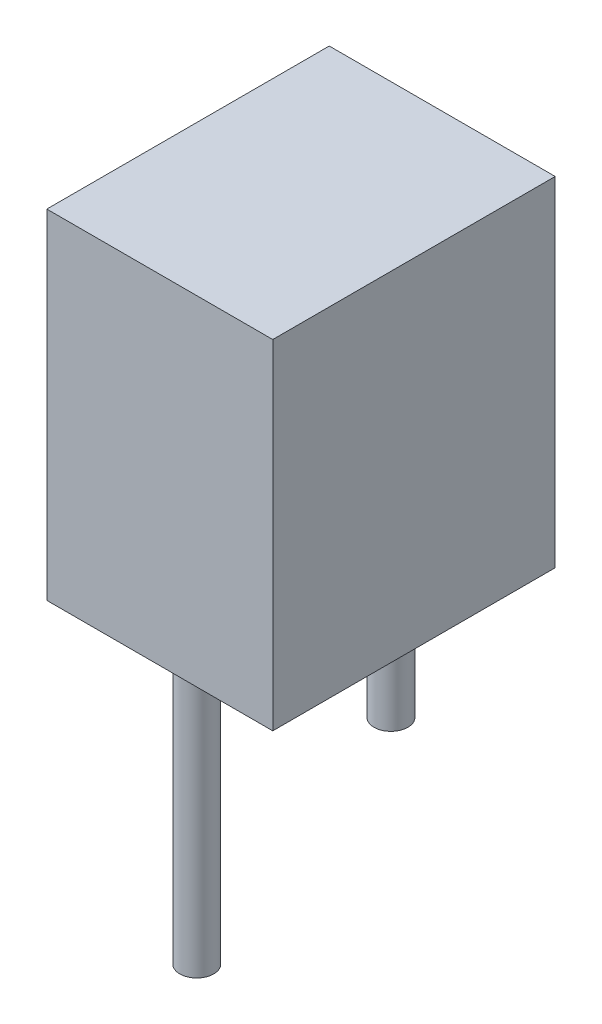
from build123d import *

# Parameters (mm, degrees)
SKETCH1_W           = 20
SKETCH1_H           = 30
BOSS_EXTRUDE1_DEPTH = 12.5
SKETCH2_R           = 1.5
BOSS_EXTRUDE2_DEPTH = 30
CUT_EXTRUDE1_START  = -21
SKETCH3_R           = 1.5
CUT_EXTRUDE1_DEPTH  = 21
CUT_EXTRUDE2_DEPTH  = 1


with BuildPart() as part:
    # Sketch1 → Boss-Extrude1 (new, symmetric)
    with BuildSketch(Plane.XY):
        Rectangle(SKETCH1_W, SKETCH1_H)
    extrude(amount=BOSS_EXTRUDE1_DEPTH, both=True)

    # Sketch2 → Boss-Extrude2 (add)
    with BuildSketch(Plane.XZ.offset(15)):
        with Locations(Location((-5.475979832, 3.75, 0), (0, 0, 180))):
            Circle(SKETCH2_R)
        with Locations(Location((5.2112799, -2.75, 0), (0, 0, 180))):
            Circle(SKETCH2_R)
    extrude(amount=BOSS_EXTRUDE2_DEPTH)

    # Sketch3 → Cut-Extrude1 (cut)
    with BuildSketch(Plane.XZ.offset(45).offset(CUT_EXTRUDE1_START)):
        with Locations(Location((5.2112799, -2.75, 0), (0, 0, 180))):
            Circle(SKETCH3_R)
    extrude(amount=CUT_EXTRUDE1_DEPTH, mode=Mode.SUBTRACT)

    # Sketch4 → Cut-Extrude2 (cut)
    # profile 1 of 17: a face of its own
    with BuildSketch(Plane(origin=(0, 0, -12.5), x_dir=(-1, 0, 0), z_dir=(0, 0, -1))):
        with BuildLine():
            Line((-5.418014107, 4.812145951), (-4.901779799, 4.812145951))
            add(Edge.make_bspline(
                [(-4.901779799, 4.812145951), (-4.876509461, 4.812013092), (-4.827529258, 4.811755578), (-4.756303846, 4.807761783), (-4.689591948, 4.802316152), (-4.627374215, 4.793675546), (-4.569679398, 4.783249619), (-4.516333625, 4.770623841), (-4.46750653, 4.755484675), (-4.409212974, 4.731410403), (-4.342749141, 4.695636341), (-4.270783689, 4.642773676), (-4.209245961, 4.578115207), (-4.156188447, 4.505178914), (-4.114005458, 4.424945324), (-4.083488191, 4.339326771), (-4.064167655, 4.249427597), (-4.062180684, 4.187709242), (-4.0611765, 4.156517779)],
                knots=[0, 0, 0, 0, 1.001505555, 1.941167018, 2.826882275, 3.653841531, 4.429895133, 5.150066043, 5.825578002, 6.45369114, 7.647487171, 8.808567382, 9.977351308, 11.170798116, 12.373658725, 13.556498008, 14.765093433, 16, 16, 16, 16], degree=3))
            add(Edge.make_bspline(
                [(-4.0611765, 4.156517779), (-4.062002921, 4.127298288), (-4.063626917, 4.069879232), (-4.079156265, 3.985897375), (-4.103468199, 3.905954489), (-4.137263238, 3.830342329), (-4.18118558, 3.7607693), (-4.23323919, 3.696674164), (-4.296041297, 3.640770687), (-4.343094222, 3.609517421), (-4.366994977, 3.593642178)],
                knots=[0, 0, 0, 0, 1.044552857, 2.05264487, 3.044412934, 4.028983338, 5.005914585, 5.980388656, 6.974128949, 8, 8, 8, 8], degree=3))
            add(Edge.make_bspline(
                [(-4.366994977, 3.593642178), (-4.336937987, 3.582102566), (-4.279431519, 3.560024429), (-4.200293879, 3.520990477), (-4.132110871, 3.478534596), (-4.074358267, 3.432170638), (-4.024966111, 3.382195525), (-3.981836804, 3.32787648), (-3.945036003, 3.268504919), (-3.913503019, 3.204699866), (-3.88889771, 3.137112833), (-3.870470687, 3.066377782), (-3.85991196, 2.992748357), (-3.858409398, 2.942639766), (-3.857650859, 2.917343434)],
                knots=[0, 0, 0, 0, 1.27268992, 2.434971085, 3.483601985, 4.442670788, 5.356604649, 6.2567628, 7.179492994, 8.113709626, 9.066344395, 10.018646069, 10.999752585, 12, 12, 12, 12], degree=3))
            add(Edge.make_bspline(
                [(-3.857650859, 2.917343434), (-3.858389308, 2.891514905), (-3.859842228, 2.840696552), (-3.870561611, 2.766042373), (-3.888711353, 2.694699408), (-3.913711565, 2.626206204), (-3.946340219, 2.560695269), (-3.986048859, 2.498092385), (-4.033395338, 2.439026552), (-4.086359531, 2.382841432), (-4.146277939, 2.332322807), (-4.210923777, 2.287331767), (-4.281111174, 2.250330875), (-4.355687383, 2.21924912), (-4.43548898, 2.195506774), (-4.520157617, 2.178896554), (-4.609620274, 2.167704651), (-4.671010979, 2.166784502), (-4.702494275, 2.166312618)],
                knots=[0, 0, 0, 0, 0.978564426, 1.925352924, 2.850884081, 3.763762016, 4.682927383, 5.618979971, 6.567305752, 7.547517671, 8.540179244, 9.531824382, 10.526200242, 11.540722885, 12.589160233, 13.674978461, 14.80764778, 16, 16, 16, 16], degree=3))
            Line((-4.702494275, 2.166312618), (-5.418014107, 2.166312618))
            Line((-5.418014107, 2.166312618), (-5.418014107, 4.812145951))
        make_face()
        with BuildLine():
            Line((-5.180567526, 4.54077843), (-5.180567526, 3.692754925))
            Line((-5.180567526, 3.692754925), (-5.021033104, 3.692754925))
            add(Edge.make_bspline(
                [(-5.021033104, 3.692754925), (-4.997712884, 3.693057248), (-4.952653466, 3.693641397), (-4.887399735, 3.695314711), (-4.826829036, 3.700000137), (-4.771045924, 3.704684216), (-4.720138244, 3.712300124), (-4.674218777, 3.721365598), (-4.632566861, 3.73095327), (-4.584533991, 3.747258775), (-4.530050274, 3.77135678), (-4.471968106, 3.808755132), (-4.420764072, 3.853299137), (-4.377525722, 3.904697067), (-4.342138479, 3.961292338), (-4.317559659, 4.022181944), (-4.300892962, 4.085848353), (-4.299387459, 4.129556199), (-4.298623082, 4.151747647)],
                knots=[0, 0, 0, 0, 1.156816544, 2.235205308, 3.236616184, 4.169592532, 5.011045266, 5.787822928, 6.49130361, 7.128639758, 8.301311294, 9.436451833, 10.541879658, 11.654887649, 12.756523258, 13.837046038, 14.901820046, 16, 16, 16, 16], degree=3))
            add(Edge.make_bspline(
                [(-4.298623082, 4.151747647), (-4.299020849, 4.166432605), (-4.299801112, 4.195238755), (-4.306191407, 4.237231421), (-4.317052609, 4.27672521), (-4.331003176, 4.314261353), (-4.350498196, 4.348666145), (-4.373451529, 4.381129156), (-4.401184164, 4.410544864), (-4.432750704, 4.438038473), (-4.469042936, 4.462413801), (-4.51003921, 4.483762473), (-4.556294181, 4.500953417), (-4.607028303, 4.51600908), (-4.663022518, 4.526583564), (-4.723630663, 4.53539297), (-4.78934917, 4.539877841), (-4.834816004, 4.540471538), (-4.858318594, 4.54077843)],
                knots=[0, 0, 0, 0, 0.91205012, 1.789085906, 2.630437955, 3.453916878, 4.269457761, 5.079663411, 5.91843418, 6.774407191, 7.675494373, 8.627863946, 9.638891023, 10.736472738, 11.911756761, 13.175263542, 14.539845004, 16, 16, 16, 16], degree=3))
            Line((-4.858318594, 4.54077843), (-5.180567526, 4.54077843))
        make_face(mode=Mode.SUBTRACT)
        with BuildLine():
            Line((-5.180567526, 3.421387404), (-5.180567526, 2.437680139))
            Line((-5.180567526, 2.437680139), (-4.842418154, 2.437680139))
            add(Edge.make_bspline(
                [(-4.842418154, 2.437680139), (-4.81821337, 2.437970234), (-4.771561842, 2.438529353), (-4.704205555, 2.440354642), (-4.641776661, 2.44450654), (-4.584560034, 2.451042391), (-4.531937847, 2.458132052), (-4.484541369, 2.46766558), (-4.441986395, 2.478588306), (-4.392642127, 2.495471877), (-4.337076975, 2.521700757), (-4.277197339, 2.561247821), (-4.223958472, 2.608361273), (-4.178748544, 2.66288881), (-4.141697059, 2.722179158), (-4.114743232, 2.785033083), (-4.098119192, 2.850412024), (-4.096106719, 2.89498805), (-4.095097441, 2.917343434)],
                knots=[0, 0, 0, 0, 1.160039823, 2.235823828, 3.228722157, 4.157150951, 4.99529583, 5.772374946, 6.472645482, 7.099169577, 8.269452708, 9.405989375, 10.527446681, 11.663510218, 12.788923519, 13.866172445, 14.929861265, 16, 16, 16, 16], degree=3))
            add(Edge.make_bspline(
                [(-4.095097441, 2.917343434), (-4.095306162, 2.931323519), (-4.095720239, 2.959058188), (-4.101964871, 2.99981598), (-4.111046784, 3.039296253), (-4.122787808, 3.077606212), (-4.139887048, 3.114053228), (-4.159849139, 3.14935814), (-4.183254484, 3.183567615), (-4.219724776, 3.226817354), (-4.272771455, 3.276647477), (-4.348145029, 3.325434756), (-4.433849088, 3.364780419), (-4.496009157, 3.381486571), (-4.528119442, 3.390116537)],
                knots=[0, 0, 0, 0, 0.723448775, 1.435228256, 2.130040452, 2.821711965, 3.505591119, 4.210454504, 4.921174351, 5.648778258, 7.137944449, 8.670945889, 10.280296675, 12, 12, 12, 12], degree=3))
            add(Edge.make_bspline(
                [(-4.528119442, 3.390116537), (-4.540992628, 3.392728416), (-4.56890435, 3.398391509), (-4.614418413, 3.404369356), (-4.666379457, 3.409695086), (-4.724907465, 3.413634473), (-4.790076488, 3.417706443), (-4.862025706, 3.419290028), (-4.940461296, 3.42117935), (-4.994884101, 3.421316279), (-5.023153163, 3.421387404)],
                knots=[0, 0, 0, 0, 0.634451884, 1.375622551, 2.216452059, 3.157844607, 4.20941857, 5.370758133, 6.634282058, 8, 8, 8, 8], degree=3))
            Line((-5.023153163, 3.421387404), (-5.180567526, 3.421387404))
        make_face(mode=Mode.SUBTRACT)
    # profile 2 of 17: a face of its own
    with BuildSketch(Plane(origin=(0, 0, -12.5), x_dir=(-1, 0, 0), z_dir=(0, 0, -1))):
        Polygon((-3.314915817, 4.812145951), (-3.077469235, 4.812145951), (-3.077469235, 2.437680139), (-2.05984103, 2.437680139), (-2.05984103, 2.166312618), (-3.314915817, 2.166312618), align=None)
    # profile 3 of 17: a face of its own
    with BuildSketch(Plane(origin=(0, 0, -12.5), x_dir=(-1, 0, 0), z_dir=(0, 0, -1))):
        with BuildLine():
            add(Edge.make_bspline(
                [(-0.380754492, 4.879987831), (-0.33176265, 4.878746951), (-0.23553863, 4.87630976), (-0.094118916, 4.857653533), (0.040890472, 4.825377851), (0.170589327, 4.782392144), (0.293426279, 4.725049841), (0.410325918, 4.655740235), (0.521010102, 4.573737198), (0.62398698, 4.479674627), (0.718221699, 4.377331183), (0.801244839, 4.268112763), (0.87082443, 4.15267974), (0.927963686, 4.031378993), (0.972790611, 3.90448485), (1.003723459, 3.771320812), (1.023482656, 3.632749684), (1.025792678, 3.538235328), (1.026964525, 3.490289314)],
                knots=[0, 0, 0, 0, 1.065120563, 2.091984664, 3.0946048, 4.079830382, 5.057816894, 6.036188127, 7.030412546, 8.04752943, 9.064399622, 10.05169764, 11.02544977, 11.989514704, 12.962713494, 13.945757189, 14.957906945, 16, 16, 16, 16], degree=3))
            add(Edge.make_bspline(
                [(1.026964525, 3.490289314), (1.02579285, 3.442696482), (1.023483343, 3.348885498), (1.003700993, 3.211193728), (0.972675951, 3.078833499), (0.928379964, 2.952025773), (0.871513085, 2.830636781), (0.801470188, 2.714985929), (0.718964629, 2.605035303), (0.625070165, 2.501989419), (0.522713425, 2.407497283), (0.412926259, 2.3251598), (0.298177737, 2.254308825), (0.176991231, 2.197775928), (0.050973942, 2.152591203), (-0.081001981, 2.121784155), (-0.218318126, 2.101912402), (-0.311958706, 2.099630548), (-0.359553904, 2.098470737)],
                knots=[0, 0, 0, 0, 1.043624062, 2.057103931, 3.04512605, 4.022047818, 4.998200453, 5.980619268, 6.982898556, 8.009068085, 9.034988726, 10.034168286, 11.015286542, 11.987931943, 12.962482838, 13.94673481, 14.956375938, 16, 16, 16, 16], degree=3))
            add(Edge.make_bspline(
                [(-0.359553904, 2.098470737), (-0.407499669, 2.099642), (-0.502013535, 2.101950871), (-0.640758794, 2.121742766), (-0.774016374, 2.152692442), (-0.901405199, 2.19692279), (-1.022996306, 2.254085815), (-1.1390275, 2.323787935), (-1.249033046, 2.406494524), (-1.352100914, 2.500358542), (-1.446405367, 2.602541798), (-1.528622276, 2.712029598), (-1.59834007, 2.826673902), (-1.655311161, 2.946792863), (-1.700414651, 3.071805799), (-1.731185555, 3.202546613), (-1.75109428, 3.33826993), (-1.75338848, 3.43067974), (-1.754552569, 3.477568961)],
                knots=[0, 0, 0, 0, 1.053102029, 2.075944431, 3.073151272, 4.055350789, 5.033113405, 6.020478099, 7.024410459, 8.052272461, 9.079885166, 10.07527673, 11.055994387, 12.023226415, 12.992069828, 13.970394897, 14.97016774, 16, 16, 16, 16], degree=3))
            add(Edge.make_bspline(
                [(-1.754552569, 3.477568961), (-1.75414841, 3.509041277), (-1.75334519, 3.57158887), (-1.74367528, 3.664470169), (-1.729643518, 3.755857749), (-1.709533739, 3.84549174), (-1.683232895, 3.933152722), (-1.652199517, 4.019445263), (-1.614296182, 4.103494864), (-1.571448311, 4.18569969), (-1.523625397, 4.264778285), (-1.470802657, 4.339526542), (-1.414835444, 4.4105717), (-1.353479784, 4.476072709), (-1.288757828, 4.537935056), (-1.219619649, 4.595208063), (-1.146487119, 4.648408174), (-1.069045559, 4.696350932), (-0.989203172, 4.739711707), (-0.906897513, 4.776921082), (-0.823246414, 4.808857093), (-0.737858079, 4.834741526), (-0.650959257, 4.855176458), (-0.562360289, 4.869091541), (-0.472131759, 4.878786115), (-0.411344631, 4.879585536), (-0.380754492, 4.879987831)],
                knots=[0, 0, 0, 0, 1.037015668, 2.060948919, 3.074880161, 4.083647147, 5.086022904, 6.090072063, 7.104153813, 8.122640571, 9.144368836, 10.147691507, 11.138137339, 12.123020368, 13.103399296, 14.087645067, 15.080126199, 16.082011238, 17.087798457, 18.072939717, 19.057185487, 20.037253025, 21.01195951, 21.997135196, 22.992090687, 24, 24, 24, 24], degree=3))
        make_face()
        with BuildLine():
            add(Edge.make_bspline(
                [(-0.369094169, 4.60862031), (-0.39420285, 4.608314232), (-0.444180172, 4.607705003), (-0.518478601, 4.599680027), (-0.591799884, 4.588242552), (-0.664159164, 4.57192795), (-0.73525368, 4.549699886), (-0.80574612, 4.524117771), (-0.874993667, 4.492956589), (-0.942767714, 4.457749843), (-1.008471372, 4.418781313), (-1.070469069, 4.37571337), (-1.128921306, 4.329556011), (-1.183684966, 4.280201515), (-1.234599245, 4.227398542), (-1.282666251, 4.171947593), (-1.325959328, 4.112263723), (-1.365635924, 4.04996538), (-1.401141375, 3.985133708), (-1.432713994, 3.918451253), (-1.458540358, 3.849374073), (-1.479602988, 3.778651585), (-1.497065345, 3.706395797), (-1.508127895, 3.632058578), (-1.516241047, 3.556013464), (-1.516815454, 3.504622419), (-1.517105988, 3.478628991)],
                knots=[0, 0, 0, 0, 1.008559885, 2.007477868, 2.99961109, 3.989939068, 4.984837346, 5.991145699, 7.001802488, 8.033829008, 9.059044045, 10.069351652, 11.065060232, 12.050310815, 13.029377138, 14.011219647, 14.996725999, 15.989392538, 16.977580475, 17.965360261, 18.951710183, 19.937753436, 20.929683414, 21.935841486, 22.955955122, 24, 24, 24, 24], degree=3))
            add(Edge.make_bspline(
                [(-1.517105988, 3.478628991), (-1.516142253, 3.440406359), (-1.514246288, 3.365210619), (-1.49764741, 3.255016844), (-1.472079608, 3.14911677), (-1.434389813, 3.048089851), (-1.387255718, 2.951067685), (-1.329027057, 2.858910963), (-1.260039534, 2.771594778), (-1.181674844, 2.689728711), (-1.096008274, 2.61500599), (-1.00504246, 2.549416985), (-0.909751936, 2.493922332), (-0.809888205, 2.448712545), (-0.705984411, 2.41288816), (-0.597371024, 2.388335861), (-0.484771569, 2.372177035), (-0.408019229, 2.370625249), (-0.369094169, 2.369838259)],
                knots=[0, 0, 0, 0, 1.032063989, 2.030389145, 3.003944642, 3.970395727, 4.937377036, 5.913328081, 6.909231446, 7.93887556, 8.970685674, 9.976071282, 10.964166581, 11.944589148, 12.933237628, 13.927779006, 14.949070134, 16, 16, 16, 16], degree=3))
            add(Edge.make_bspline(
                [(-0.369094169, 2.369838259), (-0.342931033, 2.370197717), (-0.291041679, 2.370910632), (-0.213862325, 2.378091179), (-0.138073403, 2.389605747), (-0.063781216, 2.406184279), (0.008929922, 2.42693306), (0.080363493, 2.451582949), (0.149758629, 2.482336002), (0.217990768, 2.516314513), (0.283302213, 2.555049632), (0.345649788, 2.596655852), (0.403461987, 2.642745226), (0.458184678, 2.69136643), (0.50930799, 2.743499815), (0.556486211, 2.799077602), (0.599560477, 2.858450598), (0.639222008, 2.920654447), (0.674603046, 2.985663519), (0.705430103, 3.05258774), (0.731583119, 3.121262316), (0.752695738, 3.191786302), (0.769240105, 3.264025753), (0.780639807, 3.338077396), (0.788613924, 3.413793089), (0.789214965, 3.465004218), (0.789517944, 3.490819329)],
                knots=[0, 0, 0, 0, 1.047197238, 2.076906641, 3.100256066, 4.114471768, 5.12198147, 6.126382909, 7.136867548, 8.15857795, 9.17633901, 10.174870724, 11.156907918, 12.133735059, 13.104061851, 14.077631395, 15.04955518, 16.038496417, 17.029181396, 18.010275684, 18.986308667, 19.968651475, 20.955262928, 21.950658345, 22.966943676, 24, 24, 24, 24], degree=3))
            add(Edge.make_bspline(
                [(0.789517944, 3.490819329), (0.789214722, 3.516457835), (0.788613224, 3.567316535), (0.780643616, 3.642504177), (0.769228062, 3.716022974), (0.752776491, 3.787584301), (0.73157191, 3.8572064), (0.705425535, 3.924823882), (0.674593791, 3.990688649), (0.639209003, 4.054637909), (0.599433945, 4.116002145), (0.555971035, 4.174665874), (0.50806985, 4.229527411), (0.457098986, 4.281941138), (0.401785281, 4.330789185), (0.342379296, 4.376087757), (0.27960223, 4.418930054), (0.213133427, 4.457578544), (0.14453532, 4.493270256), (0.074145601, 4.523849288), (0.002761699, 4.549832973), (-0.069434862, 4.571995203), (-0.143051757, 4.588178654), (-0.217591556, 4.599690335), (-0.292951132, 4.60770221), (-0.343632614, 4.608313306), (-0.369094169, 4.60862031)],
                knots=[0, 0, 0, 0, 1.02996197, 2.043119294, 3.035359645, 4.018872909, 4.991431989, 5.957985074, 6.929999688, 7.912076566, 8.892894881, 9.867085534, 10.843653904, 11.817741046, 12.803660682, 13.806313499, 14.818574707, 15.856120519, 16.894564902, 17.924820532, 18.937903209, 19.946497019, 20.957711757, 21.963978472, 22.977135795, 24, 24, 24, 24], degree=3))
        make_face(mode=Mode.SUBTRACT)
    # profile 4 of 17: a face of its own
    with BuildSketch(Plane(origin=(0, 0, -12.5), x_dir=(-1, 0, 0), z_dir=(0, 0, -1))):
        with BuildLine():
            add(Edge.make_bspline(
                [(2.807813884, 4.879987831), (2.856805726, 4.878746951), (2.953029746, 4.87630976), (3.09444946, 4.857653533), (3.229458848, 4.825377851), (3.359157703, 4.782392144), (3.481994655, 4.725049841), (3.598894294, 4.655740235), (3.709578479, 4.573737198), (3.812555356, 4.479674627), (3.906790075, 4.377331183), (3.989813215, 4.268112763), (4.059392806, 4.15267974), (4.116532062, 4.031378993), (4.161358987, 3.90448485), (4.192291835, 3.771320812), (4.212051032, 3.632749684), (4.214361054, 3.538235328), (4.215532901, 3.490289314)],
                knots=[0, 0, 0, 0, 1.065120563, 2.091984664, 3.0946048, 4.079830382, 5.057816894, 6.036188127, 7.030412546, 8.04752943, 9.064399622, 10.05169764, 11.02544977, 11.989514704, 12.962713494, 13.945757189, 14.957906945, 16, 16, 16, 16], degree=3))
            add(Edge.make_bspline(
                [(4.215532901, 3.490289314), (4.214361226, 3.442696482), (4.212051719, 3.348885498), (4.192269369, 3.211193728), (4.161244327, 3.078833499), (4.11694834, 2.952025773), (4.060081461, 2.830636781), (3.990038564, 2.714985929), (3.907533005, 2.605035303), (3.813638541, 2.501989419), (3.711281801, 2.407497283), (3.601494635, 2.3251598), (3.486746113, 2.254308825), (3.365559607, 2.197775928), (3.239542318, 2.152591203), (3.107566395, 2.121784155), (2.97025025, 2.101912402), (2.87660967, 2.099630548), (2.829014472, 2.098470737)],
                knots=[0, 0, 0, 0, 1.043624062, 2.057103931, 3.04512605, 4.022047818, 4.998200453, 5.980619268, 6.982898556, 8.009068085, 9.034988726, 10.034168286, 11.015286542, 11.987931943, 12.962482838, 13.94673481, 14.956375938, 16, 16, 16, 16], degree=3))
            add(Edge.make_bspline(
                [(2.829014472, 2.098470737), (2.781068707, 2.099642), (2.686554841, 2.101950871), (2.547809582, 2.121742766), (2.414552002, 2.152692442), (2.287163177, 2.19692279), (2.16557207, 2.254085815), (2.049540876, 2.323787935), (1.93953533, 2.406494524), (1.836467463, 2.500358542), (1.742163009, 2.602541798), (1.6599461, 2.712029598), (1.590228306, 2.826673902), (1.533257216, 2.946792863), (1.488153725, 3.071805799), (1.457382821, 3.202546613), (1.437474096, 3.33826993), (1.435179896, 3.43067974), (1.434015807, 3.477568961)],
                knots=[0, 0, 0, 0, 1.053102029, 2.075944431, 3.073151272, 4.055350789, 5.033113405, 6.020478099, 7.024410459, 8.052272461, 9.079885166, 10.07527673, 11.055994387, 12.023226415, 12.992069828, 13.970394897, 14.97016774, 16, 16, 16, 16], degree=3))
            add(Edge.make_bspline(
                [(1.434015807, 3.477568961), (1.434419966, 3.509041277), (1.435223186, 3.57158887), (1.444893096, 3.664470169), (1.458924858, 3.755857749), (1.479034637, 3.84549174), (1.505335481, 3.933152722), (1.536368859, 4.019445263), (1.574272194, 4.103494864), (1.617120065, 4.18569969), (1.664942979, 4.264778285), (1.717765719, 4.339526542), (1.773732932, 4.4105717), (1.835088592, 4.476072709), (1.899810548, 4.537935056), (1.968948727, 4.595208063), (2.042081257, 4.648408174), (2.119522818, 4.696350932), (2.199365204, 4.739711707), (2.281670863, 4.776921082), (2.365321962, 4.808857093), (2.450710297, 4.834741526), (2.537609119, 4.855176458), (2.626208087, 4.869091541), (2.716436617, 4.878786115), (2.777223745, 4.879585536), (2.807813884, 4.879987831)],
                knots=[0, 0, 0, 0, 1.037015668, 2.060948919, 3.074880161, 4.083647147, 5.086022904, 6.090072063, 7.104153813, 8.122640571, 9.144368836, 10.147691507, 11.138137339, 12.123020368, 13.103399296, 14.087645067, 15.080126199, 16.082011238, 17.087798457, 18.072939717, 19.057185487, 20.037253025, 21.01195951, 21.997135196, 22.992090687, 24, 24, 24, 24], degree=3))
        make_face()
        with BuildLine():
            add(Edge.make_bspline(
                [(2.819474207, 4.60862031), (2.794365526, 4.608314232), (2.744388204, 4.607705003), (2.670089775, 4.599680027), (2.596768492, 4.588242552), (2.524409212, 4.57192795), (2.453314696, 4.549699886), (2.382822256, 4.524117771), (2.313574709, 4.492956589), (2.245800662, 4.457749843), (2.180097004, 4.418781313), (2.118099307, 4.37571337), (2.05964707, 4.329556011), (2.004883411, 4.280201515), (1.953969132, 4.227398542), (1.905902125, 4.171947593), (1.862609049, 4.112263723), (1.822932452, 4.04996538), (1.787427001, 3.985133708), (1.755854382, 3.918451253), (1.730028018, 3.849374073), (1.708965388, 3.778651585), (1.691503031, 3.706395797), (1.680440481, 3.632058578), (1.672327329, 3.556013464), (1.671752922, 3.504622419), (1.671462389, 3.478628991)],
                knots=[0, 0, 0, 0, 1.008559885, 2.007477868, 2.99961109, 3.989939068, 4.984837346, 5.991145699, 7.001802488, 8.033829008, 9.059044045, 10.069351652, 11.065060232, 12.050310815, 13.029377138, 14.011219647, 14.996725999, 15.989392538, 16.977580475, 17.965360261, 18.951710183, 19.937753436, 20.929683414, 21.935841486, 22.955955122, 24, 24, 24, 24], degree=3))
            add(Edge.make_bspline(
                [(1.671462389, 3.478628991), (1.672426123, 3.440406359), (1.674322088, 3.365210619), (1.690920966, 3.255016844), (1.716488768, 3.14911677), (1.754178563, 3.048089851), (1.801312658, 2.951067685), (1.859541319, 2.858910963), (1.928528842, 2.771594778), (2.006893532, 2.689728711), (2.092560102, 2.61500599), (2.183525916, 2.549416985), (2.27881644, 2.493922332), (2.378680171, 2.448712545), (2.482583965, 2.41288816), (2.591197352, 2.388335861), (2.703796807, 2.372177035), (2.780549147, 2.370625249), (2.819474207, 2.369838259)],
                knots=[0, 0, 0, 0, 1.032063989, 2.030389145, 3.003944642, 3.970395727, 4.937377036, 5.913328081, 6.909231446, 7.93887556, 8.970685674, 9.976071282, 10.964166581, 11.944589148, 12.933237628, 13.927779006, 14.949070134, 16, 16, 16, 16], degree=3))
            add(Edge.make_bspline(
                [(2.819474207, 2.369838259), (2.845637343, 2.370197717), (2.897526697, 2.370910632), (2.974706051, 2.378091179), (3.050494973, 2.389605747), (3.12478716, 2.406184279), (3.197498298, 2.42693306), (3.268931869, 2.451582949), (3.338327005, 2.482336002), (3.406559144, 2.516314513), (3.471870589, 2.555049632), (3.534218164, 2.596655852), (3.592030363, 2.642745226), (3.646753054, 2.69136643), (3.697876367, 2.743499815), (3.745054587, 2.799077602), (3.788128853, 2.858450598), (3.827790384, 2.920654447), (3.863171422, 2.985663519), (3.893998479, 3.05258774), (3.920151495, 3.121262316), (3.941264115, 3.191786302), (3.957808481, 3.264025753), (3.969208183, 3.338077396), (3.9771823, 3.413793089), (3.977783341, 3.465004218), (3.97808632, 3.490819329)],
                knots=[0, 0, 0, 0, 1.047197238, 2.076906641, 3.100256066, 4.114471768, 5.12198147, 6.126382909, 7.136867548, 8.15857795, 9.17633901, 10.174870724, 11.156907918, 12.133735059, 13.104061851, 14.077631395, 15.04955518, 16.038496417, 17.029181396, 18.010275684, 18.986308667, 19.968651475, 20.955262928, 21.950658345, 22.966943676, 24, 24, 24, 24], degree=3))
            add(Edge.make_bspline(
                [(3.97808632, 3.490819329), (3.977783098, 3.516457835), (3.977181601, 3.567316535), (3.969211992, 3.642504177), (3.957796438, 3.716022974), (3.941344867, 3.787584301), (3.920140286, 3.8572064), (3.893993912, 3.924823882), (3.863162167, 3.990688649), (3.827777379, 4.054637909), (3.788002322, 4.116002145), (3.744539411, 4.174665874), (3.696638226, 4.229527411), (3.645667362, 4.281941138), (3.590353657, 4.330789185), (3.530947672, 4.376087757), (3.468170606, 4.418930054), (3.401701804, 4.457578544), (3.333103696, 4.493270256), (3.262713977, 4.523849288), (3.191330075, 4.549832973), (3.119133514, 4.571995203), (3.045516619, 4.588178654), (2.97097682, 4.599690335), (2.895617244, 4.60770221), (2.844935762, 4.608313306), (2.819474207, 4.60862031)],
                knots=[0, 0, 0, 0, 1.02996197, 2.043119294, 3.035359645, 4.018872909, 4.991431989, 5.957985074, 6.929999688, 7.912076566, 8.892894881, 9.867085534, 10.843653904, 11.817741046, 12.803660682, 13.806313499, 14.818574707, 15.856120519, 16.894564902, 17.924820532, 18.937903209, 19.946497019, 20.957711757, 21.963978472, 22.977135795, 24, 24, 24, 24], degree=3))
        make_face(mode=Mode.SUBTRACT)
    # profile 5 of 17: a face of its own
    with BuildSketch(Plane(origin=(0, 0, -12.5), x_dir=(-1, 0, 0), z_dir=(0, 0, -1))):
        with BuildLine():
            Line((4.758267944, 2.166312618), (4.758267944, 4.812145951))
            Line((4.758267944, 4.812145951), (5.292522752, 4.812145951))
            add(Edge.make_bspline(
                [(5.292522752, 4.812145951), (5.33899038, 4.811811389), (5.428765595, 4.811165018), (5.558496433, 4.807066704), (5.678529397, 4.799816768), (5.788469713, 4.789256472), (5.888619201, 4.776289595), (5.978697434, 4.760036313), (6.059170185, 4.740844066), (6.108661964, 4.724481136), (6.132066021, 4.716743307)],
                knots=[0, 0, 0, 0, 1.314313732, 2.53924729, 3.670748893, 4.714932338, 5.66265055, 6.526160246, 7.303039223, 8, 8, 8, 8], degree=3))
            add(Edge.make_bspline(
                [(6.132066021, 4.716743307), (6.162678116, 4.705078428), (6.223208124, 4.682013192), (6.30939208, 4.638503369), (6.390524943, 4.589205369), (6.467041797, 4.534054211), (6.537194803, 4.471488305), (6.603724582, 4.404165389), (6.663909522, 4.329637298), (6.719024722, 4.249449658), (6.76871775, 4.164547095), (6.811912233, 4.075091388), (6.847785192, 3.981536832), (6.877564595, 3.884143595), (6.901034239, 3.782697524), (6.91704677, 3.677080494), (6.927608173, 3.567709916), (6.928669569, 3.493494697), (6.929208115, 3.455838359)],
                knots=[0, 0, 0, 0, 0.984719456, 1.947108742, 2.898477687, 3.838006223, 4.779231079, 5.722358779, 6.681677486, 7.655904652, 8.64651281, 9.637519902, 10.640069247, 11.656948941, 12.698408672, 13.768548281, 14.867775369, 16, 16, 16, 16], degree=3))
            add(Edge.make_bspline(
                [(6.929208115, 3.455838359), (6.928732646, 3.423134923), (6.927795683, 3.358689386), (6.919382451, 3.263710852), (6.907153923, 3.171549997), (6.888221702, 3.082645688), (6.865238849, 2.996219), (6.835783807, 2.913191053), (6.802041497, 2.832800197), (6.762694267, 2.756133415), (6.719498101, 2.683498961), (6.673141783, 2.615028175), (6.623674758, 2.551698096), (6.570625321, 2.493316943), (6.514679012, 2.439972726), (6.455469547, 2.391219833), (6.392844146, 2.3480122), (6.327083302, 2.308651945), (6.256268609, 2.274316319), (6.179058758, 2.245265062), (6.095124474, 2.221190537), (6.004671781, 2.201104205), (5.90754439, 2.185170768), (5.803647076, 2.174491888), (5.693139471, 2.167270326), (5.617257526, 2.166638052), (5.57820067, 2.166312618)],
                knots=[0, 0, 0, 0, 1.105936401, 2.179363191, 3.223086493, 4.248585256, 5.251745608, 6.245858792, 7.225916811, 8.198733463, 9.158002045, 10.082870192, 10.993790845, 11.873723703, 12.748670949, 13.606408763, 14.465103618, 15.319838547, 16.196477973, 17.123216899, 18.106603292, 19.147568657, 20.255746949, 21.433717677, 22.679120308, 24, 24, 24, 24], degree=3))
            Line((5.57820067, 2.166312618), (4.758267944, 2.166312618))
        make_face()
        with BuildLine():
            Line((4.995714525, 2.437680139), (5.299412943, 2.437680139))
            add(Edge.make_bspline(
                [(5.299412943, 2.437680139), (5.343052842, 2.437867688), (5.42698835, 2.438228414), (5.547682194, 2.44139374), (5.657960071, 2.446565919), (5.75783764, 2.453804222), (5.84725851, 2.463381091), (5.926409559, 2.474058845), (5.995031332, 2.48736168), (6.03655537, 2.499419846), (6.055743906, 2.504992005)],
                knots=[0, 0, 0, 0, 1.375205317, 2.645023457, 3.804390687, 4.853969522, 5.800190428, 6.637939096, 7.370582563, 8, 8, 8, 8], degree=3))
            add(Edge.make_bspline(
                [(6.055743906, 2.504992005), (6.079895346, 2.513497647), (6.12762137, 2.530305774), (6.196323143, 2.560965435), (6.260395402, 2.597282952), (6.320954767, 2.637652528), (6.377142179, 2.683498018), (6.429623505, 2.733822515), (6.478293081, 2.788882137), (6.522648064, 2.848608545), (6.562341841, 2.912629997), (6.596715925, 2.980317092), (6.626841785, 3.050928192), (6.650486912, 3.125547616), (6.669019526, 3.203508273), (6.682146403, 3.284815649), (6.69032182, 3.369454558), (6.691275415, 3.427021938), (6.691761534, 3.456368374)],
                knots=[0, 0, 0, 0, 0.998632004, 1.973411704, 2.929992603, 3.868527914, 4.809262121, 5.754881198, 6.702106254, 7.672490631, 8.653608572, 9.636854334, 10.631411391, 11.644891563, 12.686317036, 13.754757253, 14.855430412, 16, 16, 16, 16], degree=3))
            add(Edge.make_bspline(
                [(6.691761534, 3.456368374), (6.691373513, 3.487312136), (6.690611243, 3.54810143), (6.681030068, 3.637296777), (6.667028654, 3.723082745), (6.646781462, 3.805465071), (6.620980143, 3.88460448), (6.588780622, 3.960063276), (6.551990976, 4.032638386), (6.50821881, 4.100654722), (6.460279642, 4.16498106), (6.407077316, 4.223911264), (6.349457085, 4.277579574), (6.288047407, 4.326821793), (6.221117576, 4.369656834), (6.15024425, 4.407973551), (6.074387701, 4.440491516), (6.021612627, 4.457786847), (5.994792216, 4.466576373)],
                knots=[0, 0, 0, 0, 1.122418816, 2.205001699, 3.251619955, 4.274784885, 5.280384055, 6.268708349, 7.249350384, 8.229342522, 9.199999885, 10.157847722, 11.105861043, 12.055065948, 13.010012805, 13.98527497, 14.976112212, 16, 16, 16, 16], degree=3))
            add(Edge.make_bspline(
                [(5.994792216, 4.466576373), (5.972604147, 4.472712006), (5.925426225, 4.485758045), (5.84844044, 4.49998913), (5.761796844, 4.512541341), (5.665110761, 4.523168549), (5.558492402, 4.530794084), (5.441859769, 4.536517637), (5.315162449, 4.540378008), (5.227333986, 4.540641614), (5.181749682, 4.54077843)],
                knots=[0, 0, 0, 0, 0.674548936, 1.434276114, 2.292660221, 3.240891867, 4.284742987, 5.42552168, 6.663806718, 8, 8, 8, 8], degree=3))
            Line((5.181749682, 4.54077843), (4.995714525, 4.54077843))
            Line((4.995714525, 4.54077843), (4.995714525, 2.437680139))
        make_face(mode=Mode.SUBTRACT)
    # profile 6 of 17: a face of its own
    with BuildSketch(Plane(origin=(0, 0, -12.5), x_dir=(-1, 0, 0), z_dir=(0, 0, -1))):
        Polygon((-4.97859564, 0.918261534), (-4.001672563, -1.198405133), (-4.208166286, -1.198405133), (-4.521086959, -0.51998633), (-5.480625554, -0.51998633), (-5.802450474, -1.198405133), (-6.009792221, -1.198405133), (-5.005732392, 0.918261534), align=None)
        Polygon((-4.994284075, 0.505698099), (-5.377590699, -0.302892313), (-4.621153733, -0.302892313), align=None, mode=Mode.SUBTRACT)
    # profile 7 of 17: a face of its own
    with BuildSketch(Plane(origin=(0, 0, -12.5), x_dir=(-1, 0, 0), z_dir=(0, 0, -1))):
        Polygon((-3.621758033, -1.198405133), (-3.621758033, 0.918261534), (-3.581900928, 0.918261534), (-2.18351017, -0.747680641), (-2.18351017, 0.918261534), (-1.993552905, 0.918261534), (-1.993552905, -1.198405133), (-2.036802104, -1.198405133), (-3.431800768, 0.463720935), (-3.431800768, -1.198405133), align=None)
    # profile 8 of 17: a face of its own
    with BuildSketch(Plane(origin=(0, 0, -12.5), x_dir=(-1, 0, 0), z_dir=(0, 0, -1))):
        Polygon((-0.582441794, 0.918261534), (0.394481283, -1.198405133), (0.18798756, -1.198405133), (-0.124933113, -0.51998633), (-1.084471708, -0.51998633), (-1.406296628, -1.198405133), (-1.613638375, -1.198405133), (-0.609578546, 0.918261534), align=None)
        Polygon((-0.598130229, 0.505698099), (-0.981436853, -0.302892313), (-0.224999887, -0.302892313), align=None, mode=Mode.SUBTRACT)
    # profile 9 of 17: a face of its own
    with BuildSketch(Plane(origin=(0, 0, -12.5), x_dir=(-1, 0, 0), z_dir=(0, 0, -1))):
        Polygon((0.774395813, 0.918261534), (0.964353078, 0.918261534), (0.964353078, -0.981311116), (1.778455642, -0.981311116), (1.778455642, -1.198405133), (0.774395813, -1.198405133), align=None)
    # profile 10 of 17: a face of its own
    with BuildSketch(Plane(origin=(0, 0, -12.5), x_dir=(-1, 0, 0), z_dir=(0, 0, -1))):
        Polygon((1.968412907, 0.918261534), (2.185930936, 0.918261534), (2.742234355, 0.008756325), (3.29768975, 0.918261534), (3.515207779, 0.918261534), (2.836788975, -0.192225245), (2.836788975, -1.198405133), (2.64683171, -1.198405133), (2.64683171, -0.192225245), align=None)
    # profile 11 of 17: a face of its own
    with BuildSketch(Plane(origin=(0, 0, -12.5), x_dir=(-1, 0, 0), z_dir=(0, 0, -1))):
        with BuildLine():
            Line((3.678028292, -0.790081816), (3.856961251, -0.682806843))
            add(Edge.make_bspline(
                [(3.856961251, -0.682806843), (3.873603233, -0.710664828), (3.905488627, -0.764039652), (3.958678259, -0.836162372), (4.013791972, -0.897462343), (4.071237902, -0.947582958), (4.130665404, -0.987042999), (4.192462427, -1.014984349), (4.256420722, -1.032411153), (4.299947747, -1.034527872), (4.321678131, -1.03558462)],
                knots=[0, 0, 0, 0, 1.272034388, 2.437168799, 3.508375237, 4.49857839, 5.41946034, 6.295179144, 7.148887113, 8, 8, 8, 8], degree=3))
            add(Edge.make_bspline(
                [(4.321678131, -1.03558462), (4.340236376, -1.035067747), (4.377028138, -1.034043044), (4.431191971, -1.024197035), (4.483795251, -1.009070653), (4.533753809, -0.987407518), (4.580378299, -0.961198053), (4.621264253, -0.929541079), (4.656610236, -0.894098278), (4.685523367, -0.854557339), (4.707706055, -0.812032207), (4.724755544, -0.768382941), (4.734217089, -0.722923854), (4.735642363, -0.692316574), (4.736361625, -0.676870678)],
                knots=[0, 0, 0, 0, 1.095163259, 2.171163733, 3.241058638, 4.321873601, 5.38011039, 6.391990106, 7.366004449, 8.327778327, 9.272591725, 10.192022065, 11.087607919, 12, 12, 12, 12], degree=3))
            add(Edge.make_bspline(
                [(4.736361625, -0.676870678), (4.735470018, -0.659247402), (4.733657511, -0.623421858), (4.718337997, -0.570565877), (4.694238691, -0.518258466), (4.672006044, -0.485902939), (4.660463521, -0.469104919)],
                knots=[0, 0, 0, 0, 0.938893495, 1.908633276, 2.914225137, 4, 4, 4, 4], degree=3))
            add(Edge.make_bspline(
                [(4.660463521, -0.469104919), (4.650986531, -0.456981364), (4.631090775, -0.431529477), (4.596886946, -0.393644025), (4.556751248, -0.354565266), (4.512057193, -0.31280098), (4.461176706, -0.270293598), (4.4057034, -0.225016115), (4.344220971, -0.1786904), (4.301101752, -0.147622229), (4.278852944, -0.131591565)],
                knots=[0, 0, 0, 0, 0.722233717, 1.516239348, 2.393582979, 3.351407094, 4.387010283, 5.505090956, 6.712668013, 8, 8, 8, 8], degree=3))
            add(Edge.make_bspline(
                [(4.278852944, -0.131591565), (4.256583194, -0.115729514), (4.214005128, -0.085402481), (4.154461128, -0.04039351), (4.101215191, 0.000756831), (4.054503976, 0.038435924), (4.01434803, 0.07264888), (3.980430919, 0.103067157), (3.953616649, 0.130513406), (3.938705893, 0.148318408), (3.932011331, 0.156312415)],
                knots=[0, 0, 0, 0, 1.452282411, 2.77665338, 3.964542531, 5.026858415, 5.96415736, 6.766646006, 7.446254459, 8, 8, 8, 8], degree=3))
            add(Edge.make_bspline(
                [(3.932011331, 0.156312415), (3.922654125, 0.168771137), (3.904251924, 0.193272887), (3.879961054, 0.231569348), (3.859314989, 0.27077199), (3.84313015, 0.310986155), (3.829501103, 0.351647279), (3.820334164, 0.39328589), (3.814594129, 0.435715149), (3.814006309, 0.464268076), (3.813712052, 0.478561347)],
                knots=[0, 0, 0, 0, 1.068054152, 2.10047183, 3.106115577, 4.101338837, 5.06977816, 6.043150881, 7.020423561, 8, 8, 8, 8], degree=3))
            add(Edge.make_bspline(
                [(3.813712052, 0.478561347), (3.814501393, 0.500955544), (3.816063203, 0.545265277), (3.829271516, 0.609993446), (3.850119408, 0.671791899), (3.879326317, 0.730048815), (3.916977192, 0.783247289), (3.960547853, 0.831999255), (4.012443371, 0.872983112), (4.06938329, 0.908792309), (4.131707858, 0.936820559), (4.197016643, 0.957963628), (4.265413444, 0.969943512), (4.311740101, 0.971662708), (4.335246507, 0.972535038)],
                knots=[0, 0, 0, 0, 1.005424448, 1.989358655, 2.955360095, 3.929531133, 4.905563448, 5.876582895, 6.856512386, 7.866279853, 8.892233794, 9.918561126, 10.94386622, 12, 12, 12, 12], degree=3))
            add(Edge.make_bspline(
                [(4.335246507, 0.972535038), (4.360189368, 0.971674733), (4.409792757, 0.969963861), (4.482756806, 0.955088211), (4.553006383, 0.930473995), (4.609517309, 0.902540854), (4.653745218, 0.874642331), (4.687474442, 0.849230342), (4.721654043, 0.81997492), (4.756559724, 0.786798137), (4.791600027, 0.749395578), (4.827295163, 0.7080234), (4.863728601, 0.662934435), (4.887166669, 0.630746285), (4.899182138, 0.614245107)],
                knots=[0, 0, 0, 0, 1.286793592, 2.559021753, 3.825965368, 5.121522368, 5.803751409, 6.523245864, 7.299691795, 8.125521123, 9.008227632, 9.944561021, 10.946284179, 12, 12, 12, 12], degree=3))
            Line((4.899182138, 0.614245107), (4.727457378, 0.484073499))
            add(Edge.make_bspline(
                [(4.727457378, 0.484073499), (4.717088171, 0.497431898), (4.697119504, 0.52315705), (4.6668031, 0.559183512), (4.638228917, 0.592092526), (4.610077009, 0.620676675), (4.583834194, 0.646501298), (4.558363411, 0.668611247), (4.534031208, 0.687223154), (4.503359553, 0.707085688), (4.464825504, 0.726774621), (4.416453903, 0.743435254), (4.365904108, 0.753447125), (4.331475236, 0.754770881), (4.31404592, 0.755441021)],
                knots=[0, 0, 0, 0, 1.181633172, 2.275549214, 3.290209073, 4.226197932, 5.078386478, 5.862611352, 6.581680152, 7.217281963, 8.414376989, 9.595101626, 10.782541182, 12, 12, 12, 12], degree=3))
            add(Edge.make_bspline(
                [(4.31404592, 0.755441021), (4.292179833, 0.754708231), (4.250013143, 0.753295114), (4.190147619, 0.737861599), (4.136267007, 0.713561141), (4.089970932, 0.679503988), (4.051425237, 0.639153673), (4.023542412, 0.592720746), (4.006760169, 0.541447579), (4.004712276, 0.505680958), (4.003669317, 0.487465593)],
                knots=[0, 0, 0, 0, 1.14458467, 2.207223713, 3.21896685, 4.227309161, 5.202851033, 6.127160689, 7.046193047, 8, 8, 8, 8], degree=3))
            add(Edge.make_bspline(
                [(4.003669317, 0.487465593), (4.003907065, 0.476125413), (4.00438295, 0.45342651), (4.01102009, 0.419891603), (4.019546827, 0.386441412), (4.033058799, 0.353226326), (4.051712864, 0.319665452), (4.076208851, 0.285180877), (4.107059759, 0.249468653), (4.130692047, 0.226241337), (4.143169184, 0.213978013)],
                knots=[0, 0, 0, 0, 0.858281714, 1.717966888, 2.583508476, 3.4729293, 4.427298488, 5.488583878, 6.674047936, 8, 8, 8, 8], degree=3))
            add(Edge.make_bspline(
                [(4.143169184, 0.213978013), (4.14780249, 0.20984324), (4.158810165, 0.200019967), (4.178934177, 0.183937969), (4.205509107, 0.164100102), (4.23784101, 0.139554439), (4.276526034, 0.111081364), (4.321568432, 0.079044941), (4.372466121, 0.042405164), (4.40858366, 0.016788937), (4.427681069, 0.003244172)],
                knots=[0, 0, 0, 0, 0.420754252, 0.999615792, 1.744751191, 2.668019286, 3.750313428, 4.999500688, 6.413464383, 8, 8, 8, 8], degree=3))
            add(Edge.make_bspline(
                [(4.427681069, 0.003244172), (4.450653503, -0.013472269), (4.495136436, -0.04584134), (4.558429353, -0.09447368), (4.615817513, -0.142036855), (4.667502403, -0.188227122), (4.713994629, -0.232694111), (4.754778393, -0.275972797), (4.790269257, -0.317753119), (4.828477641, -0.371318439), (4.867519751, -0.437105094), (4.901048663, -0.517706696), (4.92219014, -0.598621613), (4.924954818, -0.653005938), (4.92631889, -0.67983876)],
                knots=[0, 0, 0, 0, 1.163667725, 2.253281268, 3.268753668, 4.215851969, 5.092017293, 5.902905408, 6.650798638, 7.335211899, 8.59617414, 9.77448103, 10.901945474, 12, 12, 12, 12], degree=3))
            add(Edge.make_bspline(
                [(4.92631889, -0.67983876), (4.925921478, -0.6988152), (4.925134371, -0.73639957), (4.91608658, -0.791587164), (4.902830402, -0.845187738), (4.882850741, -0.896538744), (4.858464831, -0.946579624), (4.827521434, -0.993997735), (4.791654406, -1.039842557), (4.750510176, -1.082891621), (4.705488131, -1.122410511), (4.65790323, -1.157564753), (4.607677588, -1.186876549), (4.555083673, -1.210795391), (4.500109403, -1.229502804), (4.442773267, -1.243057254), (4.382980753, -1.251376184), (4.342340462, -1.252239639), (4.321678131, -1.252678637)],
                knots=[0, 0, 0, 0, 0.983748083, 1.948392443, 2.894712957, 3.844097841, 4.80183111, 5.778335162, 6.776009319, 7.81870978, 8.863265674, 9.881300176, 10.883814829, 11.87499822, 12.874611388, 13.892143829, 14.928324115, 16, 16, 16, 16], degree=3))
            add(Edge.make_bspline(
                [(4.321678131, -1.252678637), (4.305691043, -1.252369494), (4.273918207, -1.251755101), (4.226922473, -1.246323565), (4.18087615, -1.238638793), (4.136357037, -1.226438284), (4.092791554, -1.211635541), (4.050369179, -1.193409025), (4.009069351, -1.171566718), (3.968660623, -1.14659306), (3.929245765, -1.117529567), (3.891194467, -1.083678928), (3.853258246, -1.045974742), (3.81655682, -1.003393116), (3.780347823, -0.956621989), (3.745345166, -0.905223769), (3.710824318, -0.849478417), (3.689164487, -0.810250484), (3.678028292, -0.790081816)],
                knots=[0, 0, 0, 0, 0.915332311, 1.819136955, 2.706846663, 3.586547465, 4.459518054, 5.340707479, 6.227863349, 7.133153174, 8.059268498, 9.028702269, 10.047606654, 11.120612155, 12.245963614, 13.433783089, 14.680604001, 16, 16, 16, 16], degree=3))
        make_face()
    # profile 12 of 17: a face of its own
    with BuildSketch(Plane(origin=(0, 0, -12.5), x_dir=(-1, 0, 0), z_dir=(0, 0, -1))):
        Polygon((5.360506924, 0.918261534), (6.554524018, 0.918261534), (6.554524018, 0.701167516), (5.550464189, 0.701167516), (5.550464189, 0.049885465), (6.554524018, 0.049885465), (6.554524018, -0.167208552), (5.550464189, -0.167208552), (5.550464189, -0.981311116), (6.554524018, -0.981311116), (6.554524018, -1.198405133), (5.360506924, -1.198405133), align=None)
    # profile 13 of 17: a face of its own
    with BuildSketch(Plane(origin=(0, 0, -12.5), x_dir=(-1, 0, 0), z_dir=(0, 0, -1))):
        with BuildLine():
            Line((-5.000555041, -2.144487131), (-4.535944164, -2.144487131))
            add(Edge.make_bspline(
                [(-4.535944164, -2.144487131), (-4.51320086, -2.144606704), (-4.469118677, -2.144838467), (-4.405015806, -2.148432883), (-4.344975098, -2.153333951), (-4.288979138, -2.161110496), (-4.237053803, -2.17049383), (-4.189042607, -2.18185703), (-4.145098222, -2.19548228), (-4.092634021, -2.217149125), (-4.032816571, -2.24934578), (-3.968047665, -2.296922179), (-3.912663709, -2.355114801), (-3.864911947, -2.420757465), (-3.826947257, -2.492967695), (-3.799481717, -2.570024394), (-3.782093234, -2.65093365), (-3.78030496, -2.706480169), (-3.779401195, -2.734552486)],
                knots=[0, 0, 0, 0, 1.001505555, 1.941167018, 2.826882275, 3.653841531, 4.429895133, 5.150066043, 5.825578002, 6.45369114, 7.647487171, 8.808567382, 9.977351308, 11.170798116, 12.373658725, 13.556498008, 14.765093433, 16, 16, 16, 16], degree=3))
            add(Edge.make_bspline(
                [(-3.779401195, -2.734552486), (-3.780144974, -2.760850028), (-3.78160657, -2.812527179), (-3.795582983, -2.88811085), (-3.817463723, -2.960059447), (-3.847879259, -3.028110391), (-3.887409367, -3.090726117), (-3.934257616, -3.148411739), (-3.990779512, -3.198724869), (-4.033127145, -3.226852808), (-4.054637824, -3.241140527)],
                knots=[0, 0, 0, 0, 1.044552857, 2.05264487, 3.044412934, 4.028983338, 5.005914585, 5.980388656, 6.974128949, 8, 8, 8, 8], degree=3))
            add(Edge.make_bspline(
                [(-4.054637824, -3.241140527), (-4.027586533, -3.251526178), (-3.975830712, -3.271396501), (-3.904606836, -3.306527058), (-3.843242129, -3.344737351), (-3.791264785, -3.386464913), (-3.746811844, -3.431442515), (-3.707995468, -3.480329655), (-3.674874748, -3.53376406), (-3.646495062, -3.591188608), (-3.624350283, -3.652016937), (-3.607765963, -3.715678483), (-3.598263109, -3.781944966), (-3.596910803, -3.827042698), (-3.596228118, -3.849809397)],
                knots=[0, 0, 0, 0, 1.27268992, 2.434971085, 3.483601985, 4.442670788, 5.356604649, 6.2567628, 7.179492994, 8.113709626, 9.066344395, 10.018646069, 10.999752585, 12, 12, 12, 12], degree=3))
            add(Edge.make_bspline(
                [(-3.596228118, -3.849809397), (-3.596892722, -3.873055072), (-3.59820035, -3.91879159), (-3.607847795, -3.985980351), (-3.624182562, -4.05018902), (-3.646682753, -4.111832904), (-3.676048542, -4.170792745), (-3.711786318, -4.227135341), (-3.754398149, -4.280294591), (-3.802065923, -4.330861199), (-3.855992489, -4.376327961), (-3.914173744, -4.416819897), (-3.977342401, -4.4501207), (-4.04446099, -4.478094279), (-4.116282426, -4.499462391), (-4.1924842, -4.514411589), (-4.273000591, -4.524484301), (-4.328252226, -4.525312435), (-4.356587193, -4.525737131)],
                knots=[0, 0, 0, 0, 0.978564426, 1.925352924, 2.850884081, 3.763762016, 4.682927383, 5.618979971, 6.567305752, 7.547517671, 8.540179244, 9.531824382, 10.526200242, 11.540722885, 12.589160233, 13.674978461, 14.80764778, 16, 16, 16, 16], degree=3))
            Line((-4.356587193, -4.525737131), (-5.000555041, -4.525737131))
            Line((-5.000555041, -4.525737131), (-5.000555041, -2.144487131))
        make_face()
        with BuildLine():
            Line((-4.786853118, -2.388717901), (-4.786853118, -3.151939054))
            Line((-4.786853118, -3.151939054), (-4.643272138, -3.151939054))
            add(Edge.make_bspline(
                [(-4.643272138, -3.151939054), (-4.62228394, -3.151666964), (-4.581730464, -3.15114123), (-4.523002106, -3.149635247), (-4.468488477, -3.145418364), (-4.418283677, -3.141202693), (-4.372466764, -3.134348376), (-4.331139244, -3.126189449), (-4.29365252, -3.117560544), (-4.250422936, -3.10288559), (-4.201387591, -3.081197386), (-4.14911364, -3.047538868), (-4.103030009, -3.007449264), (-4.064115494, -2.961191127), (-4.032266976, -2.910255383), (-4.010146038, -2.855454738), (-3.99514601, -2.798154969), (-3.993791058, -2.758817908), (-3.993103118, -2.738845605)],
                knots=[0, 0, 0, 0, 1.156816544, 2.235205308, 3.236616184, 4.169592532, 5.011045266, 5.787822928, 6.49130361, 7.128639758, 8.301311294, 9.436451833, 10.541879658, 11.654887649, 12.756523258, 13.837046038, 14.901820046, 16, 16, 16, 16], degree=3))
            add(Edge.make_bspline(
                [(-3.993103118, -2.738845605), (-3.993461109, -2.725629142), (-3.994163346, -2.699703608), (-3.999914611, -2.661910208), (-4.009689693, -2.626365798), (-4.022245203, -2.592583269), (-4.039790721, -2.561618957), (-4.06044872, -2.532402247), (-4.085408092, -2.505928109), (-4.113817978, -2.481183861), (-4.146480987, -2.459246067), (-4.183377634, -2.440032262), (-4.225007107, -2.424560412), (-4.270667818, -2.411010315), (-4.321062611, -2.40149328), (-4.375609941, -2.393564814), (-4.434756598, -2.389528431), (-4.475676748, -2.388994103), (-4.49682908, -2.388717901)],
                knots=[0, 0, 0, 0, 0.91205012, 1.789085906, 2.630437955, 3.453916878, 4.269457761, 5.079663411, 5.91843418, 6.774407191, 7.675494373, 8.627863946, 9.638891023, 10.736472738, 11.911756761, 13.175263542, 14.539845004, 16, 16, 16, 16], degree=3))
            Line((-4.49682908, -2.388717901), (-4.786853118, -2.388717901))
        make_face(mode=Mode.SUBTRACT)
        with BuildLine():
            Line((-4.786853118, -3.396169824), (-4.786853118, -4.281506362))
            Line((-4.786853118, -4.281506362), (-4.482518683, -4.281506362))
            add(Edge.make_bspline(
                [(-4.482518683, -4.281506362), (-4.460734378, -4.281245277), (-4.418748002, -4.280742069), (-4.358127344, -4.27909931), (-4.301941339, -4.275362601), (-4.250446375, -4.269480335), (-4.203086407, -4.26309964), (-4.160429577, -4.254519465), (-4.1221301, -4.244689012), (-4.077720259, -4.229493798), (-4.027711622, -4.205887806), (-3.97381995, -4.170295449), (-3.925904969, -4.127893341), (-3.885216034, -4.078818559), (-3.851869697, -4.025457245), (-3.827611254, -3.968888712), (-3.812649617, -3.910047666), (-3.810838391, -3.869929242), (-3.809930041, -3.849809397)],
                knots=[0, 0, 0, 0, 1.160039823, 2.235823828, 3.228722157, 4.157150951, 4.99529583, 5.772374946, 6.472645482, 7.099169577, 8.269452708, 9.405989375, 10.527446681, 11.663510218, 12.788923519, 13.866172445, 14.929861265, 16, 16, 16, 16], degree=3))
            add(Edge.make_bspline(
                [(-3.809930041, -3.849809397), (-3.810117891, -3.837227321), (-3.81049056, -3.812266118), (-3.816110728, -3.775584105), (-3.82428445, -3.740051859), (-3.834851372, -3.705572897), (-3.850240688, -3.672770582), (-3.86820657, -3.640996162), (-3.889271381, -3.610207634), (-3.922094643, -3.571282868), (-3.969836654, -3.526435758), (-4.037672871, -3.482527207), (-4.114806524, -3.44711611), (-4.170750586, -3.432080573), (-4.199649843, -3.424313604)],
                knots=[0, 0, 0, 0, 0.723448775, 1.435228256, 2.130040452, 2.821711965, 3.505591119, 4.210454504, 4.921174351, 5.648778258, 7.137944449, 8.670945889, 10.280296675, 12, 12, 12, 12], degree=3))
            add(Edge.make_bspline(
                [(-4.199649843, -3.424313604), (-4.21123571, -3.421962913), (-4.236356259, -3.41686613), (-4.277318917, -3.411486067), (-4.324083856, -3.40669291), (-4.376759064, -3.403147462), (-4.435411184, -3.399482689), (-4.500165481, -3.398057462), (-4.570757511, -3.396357073), (-4.619738035, -3.396233837), (-4.645180191, -3.396169824)],
                knots=[0, 0, 0, 0, 0.634451884, 1.375622551, 2.216452059, 3.157844607, 4.20941857, 5.370758133, 6.634282058, 8, 8, 8, 8], degree=3))
            Line((-4.645180191, -3.396169824), (-4.786853118, -3.396169824))
        make_face(mode=Mode.SUBTRACT)
    # profile 14 of 17: a face of its own
    with BuildSketch(Plane(origin=(0, 0, -12.5), x_dir=(-1, 0, 0), z_dir=(0, 0, -1))):
        Polygon((-3.10776658, -2.144487131), (-2.894064657, -2.144487131), (-2.894064657, -4.281506362), (-1.978199272, -4.281506362), (-1.978199272, -4.525737131), (-3.10776658, -4.525737131), align=None)
    # profile 15 of 17: a face of its own
    with BuildSketch(Plane(origin=(0, 0, -12.5), x_dir=(-1, 0, 0), z_dir=(0, 0, -1))):
        with BuildLine():
            add(Edge.make_bspline(
                [(-0.467021387, -2.083429439), (-0.42292873, -2.084546231), (-0.336327112, -2.086739703), (-0.209049369, -2.103530308), (-0.08754092, -2.132578421), (0.029188049, -2.171265557), (0.139741307, -2.22287363), (0.244950982, -2.285252276), (0.344566748, -2.359055009), (0.437245938, -2.443711323), (0.522057184, -2.535820423), (0.59677801, -2.634117001), (0.659399642, -2.738006722), (0.710824972, -2.847177394), (0.751169205, -2.961382122), (0.779008769, -3.081229756), (0.796792046, -3.205943772), (0.798871066, -3.291006692), (0.799925728, -3.334158105)],
                knots=[0, 0, 0, 0, 1.065120563, 2.091984664, 3.0946048, 4.079830382, 5.057816894, 6.036188127, 7.030412546, 8.04752943, 9.064399622, 10.05169764, 11.02544977, 11.989514704, 12.962713494, 13.945757189, 14.957906945, 16, 16, 16, 16], degree=3))
            add(Edge.make_bspline(
                [(0.799925728, -3.334158105), (0.79887122, -3.376991653), (0.796792664, -3.461421539), (0.778988549, -3.585344132), (0.751066011, -3.704468338), (0.711199623, -3.818595292), (0.660019432, -3.927845384), (0.596980824, -4.031931151), (0.522725822, -4.130886715), (0.438220804, -4.22362801), (0.346099737, -4.308670932), (0.247291288, -4.382774667), (0.144017619, -4.446540545), (0.034949764, -4.497420152), (-0.078465797, -4.538086405), (-0.197244128, -4.565812748), (-0.320828658, -4.583697325), (-0.40510518, -4.585750994), (-0.447940858, -4.586794824)],
                knots=[0, 0, 0, 0, 1.043624062, 2.057103931, 3.04512605, 4.022047818, 4.998200453, 5.980619268, 6.982898556, 8.009068085, 9.034988726, 10.034168286, 11.015286542, 11.987931943, 12.962482838, 13.94673481, 14.956375938, 16, 16, 16, 16], degree=3))
            add(Edge.make_bspline(
                [(-0.447940858, -4.586794824), (-0.491092047, -4.585740687), (-0.576154526, -4.583662704), (-0.701025259, -4.565849998), (-0.820957081, -4.537995289), (-0.935607024, -4.498187977), (-1.04503902, -4.446741254), (-1.149467094, -4.384009346), (-1.248472086, -4.309573416), (-1.341233167, -4.2250958), (-1.426107175, -4.133130869), (-1.500102393, -4.034591849), (-1.562848408, -3.931411976), (-1.614122389, -3.82330491), (-1.65471553, -3.710793268), (-1.682409344, -3.593126536), (-1.700327197, -3.470975551), (-1.702391977, -3.387806722), (-1.703439657, -3.345606422)],
                knots=[0, 0, 0, 0, 1.053102029, 2.075944431, 3.073151272, 4.055350789, 5.033113405, 6.020478099, 7.024410459, 8.052272461, 9.079885166, 10.07527673, 11.055994387, 12.023226415, 12.992069828, 13.970394897, 14.97016774, 16, 16, 16, 16], degree=3))
            add(Edge.make_bspline(
                [(-1.703439657, -3.345606422), (-1.703075913, -3.317281338), (-1.702353016, -3.260988504), (-1.693650097, -3.177395335), (-1.681021511, -3.095146513), (-1.662922709, -3.014475921), (-1.63925195, -2.935581037), (-1.61132191, -2.85791775), (-1.577208908, -2.78227311), (-1.538645825, -2.708288766), (-1.495605202, -2.63711803), (-1.448064736, -2.5698446), (-1.397694245, -2.505903957), (-1.34247415, -2.446953049), (-1.28422439, -2.391276937), (-1.222000029, -2.339731231), (-1.156180752, -2.29185113), (-1.086483347, -2.248702648), (-1.0146252, -2.209677951), (-0.940550106, -2.176189514), (-0.865264117, -2.147447104), (-0.788414616, -2.124151114), (-0.710205676, -2.105759675), (-0.630466605, -2.0932361), (-0.549260927, -2.084510984), (-0.494552512, -2.083791505), (-0.467021387, -2.083429439)],
                knots=[0, 0, 0, 0, 1.037015668, 2.060948919, 3.074880161, 4.083647147, 5.086022904, 6.090072063, 7.104153813, 8.122640571, 9.144368836, 10.147691507, 11.138137339, 12.123020368, 13.103399296, 14.087645067, 15.080126199, 16.082011238, 17.087798457, 18.072939717, 19.057185487, 20.037253025, 21.01195951, 21.997135196, 22.992090687, 24, 24, 24, 24], degree=3))
        make_face()
        with BuildLine():
            add(Edge.make_bspline(
                [(-0.456527096, -2.327660208), (-0.47912491, -2.327935678), (-0.524104499, -2.328483985), (-0.590973086, -2.335706463), (-0.656962241, -2.346000191), (-0.722085592, -2.360683332), (-0.786070657, -2.38068859), (-0.849513853, -2.403712493), (-0.911836645, -2.431757557), (-0.972833287, -2.463443629), (-1.031966579, -2.498515305), (-1.087764507, -2.537276454), (-1.14037152, -2.578818077), (-1.189658814, -2.623237124), (-1.235481665, -2.670759799), (-1.278741971, -2.720665653), (-1.317705739, -2.774381136), (-1.353414677, -2.830449645), (-1.385369582, -2.88879815), (-1.41378494, -2.94881236), (-1.437028667, -3.010981821), (-1.455985034, -3.074632061), (-1.471701155, -3.13966227), (-1.48165745, -3.206565767), (-1.488959287, -3.27500637), (-1.489476254, -3.32125831), (-1.489737733, -3.344652396)],
                knots=[0, 0, 0, 0, 1.008559885, 2.007477868, 2.99961109, 3.989939068, 4.984837346, 5.991145699, 7.001802488, 8.033829008, 9.059044045, 10.069351652, 11.065060232, 12.050310815, 13.029377138, 14.011219647, 14.996725999, 15.989392538, 16.977580475, 17.965360261, 18.951710183, 19.937753436, 20.929683414, 21.935841486, 22.955955122, 24, 24, 24, 24], degree=3))
            add(Edge.make_bspline(
                [(-1.489737733, -3.344652396), (-1.488870372, -3.379052764), (-1.487164004, -3.44672893), (-1.472225014, -3.545903328), (-1.449213992, -3.641213394), (-1.415293177, -3.732137622), (-1.372872491, -3.819457571), (-1.320466696, -3.902398621), (-1.258377925, -3.980983187), (-1.187849704, -4.054662647), (-1.110749791, -4.121913096), (-1.028880559, -4.180943201), (-0.943119087, -4.230888389), (-0.853241729, -4.271577197), (-0.759728314, -4.303819143), (-0.661976266, -4.325916212), (-0.560636757, -4.340459156), (-0.491559651, -4.341855763), (-0.456527096, -4.342564054)],
                knots=[0, 0, 0, 0, 1.032063989, 2.030389145, 3.003944642, 3.970395727, 4.937377036, 5.913328081, 6.909231446, 7.93887556, 8.970685674, 9.976071282, 10.964166581, 11.944589148, 12.933237628, 13.927779006, 14.949070134, 16, 16, 16, 16], degree=3))
            add(Edge.make_bspline(
                [(-0.456527096, -4.342564054), (-0.432980275, -4.342240542), (-0.386279855, -4.341598919), (-0.316818438, -4.335136426), (-0.248608408, -4.324773315), (-0.181745439, -4.309852637), (-0.116305415, -4.291178734), (-0.052015201, -4.268993833), (0.010440421, -4.241316085), (0.071849347, -4.210735426), (0.130629647, -4.175873818), (0.186742465, -4.13842822), (0.238773444, -4.096947784), (0.288023865, -4.0531887), (0.334034847, -4.006268654), (0.376495245, -3.956248646), (0.415262085, -3.902812949), (0.450957462, -3.846829485), (0.482800396, -3.78832132), (0.510544748, -3.728089522), (0.534082462, -3.666282403), (0.55308382, -3.602810816), (0.56797375, -3.537795309), (0.578233481, -3.471148831), (0.585410187, -3.403004707), (0.585951123, -3.356914691), (0.586223805, -3.333681092)],
                knots=[0, 0, 0, 0, 1.047197238, 2.076906641, 3.100256066, 4.114471768, 5.12198147, 6.126382909, 7.136867548, 8.15857795, 9.17633901, 10.174870724, 11.156907918, 12.133735059, 13.104061851, 14.077631395, 15.04955518, 16.038496417, 17.029181396, 18.010275684, 18.986308667, 19.968651475, 20.955262928, 21.950658345, 22.966943676, 24, 24, 24, 24], degree=3))
            add(Edge.make_bspline(
                [(0.586223805, -3.333681092), (0.585950905, -3.310606436), (0.585409557, -3.264833606), (0.578236909, -3.197164728), (0.567962911, -3.130997811), (0.553156497, -3.066592616), (0.534072375, -3.003932727), (0.510540637, -2.943076993), (0.482792067, -2.883798703), (0.450945758, -2.826244369), (0.415148206, -2.771016556), (0.376031587, -2.718219201), (0.33292052, -2.668843818), (0.287046742, -2.621671463), (0.237264408, -2.577708221), (0.183799022, -2.536939506), (0.127299663, -2.498381439), (0.06747774, -2.463597798), (0.005739443, -2.431475257), (-0.057611303, -2.403954128), (-0.121856816, -2.380568811), (-0.186833721, -2.360622805), (-0.253088926, -2.346057698), (-0.320174745, -2.335697186), (-0.387998364, -2.328486498), (-0.433611697, -2.327936512), (-0.456527096, -2.327660208)],
                knots=[0, 0, 0, 0, 1.02996197, 2.043119294, 3.035359645, 4.018872909, 4.991431989, 5.957985074, 6.929999688, 7.912076566, 8.892894881, 9.867085534, 10.843653904, 11.817741046, 12.803660682, 13.806313499, 14.818574707, 15.856120519, 16.894564902, 17.924820532, 18.937903209, 19.946497019, 20.957711757, 21.963978472, 22.977135795, 24, 24, 24, 24], degree=3))
        make_face(mode=Mode.SUBTRACT)
    # profile 16 of 17: a face of its own
    with BuildSketch(Plane(origin=(0, 0, -12.5), x_dir=(-1, 0, 0), z_dir=(0, 0, -1))):
        with BuildLine():
            Line((3.48646419, -2.581431242), (3.299475007, -2.724535208))
            add(Edge.make_bspline(
                [(3.299475007, -2.724535208), (3.286136001, -2.708638004), (3.259637827, -2.677057924), (3.217007191, -2.632712555), (3.172578752, -2.591166368), (3.126369493, -2.552221446), (3.077547663, -2.517239683), (3.027295941, -2.484398093), (2.9747737, -2.454960578), (2.902144395, -2.419267011), (2.807133984, -2.382020073), (2.687530709, -2.350789482), (2.562677622, -2.330908647), (2.477498541, -2.328755424), (2.434173024, -2.327660208)],
                knots=[0, 0, 0, 0, 0.757959112, 1.505699292, 2.245454638, 2.979532153, 3.711538275, 4.438200793, 5.171680507, 5.909471876, 7.393775596, 8.890124382, 10.418191784, 12, 12, 12, 12], degree=3))
            add(Edge.make_bspline(
                [(2.434173024, -2.327660208), (2.41030385, -2.327935047), (2.362787032, -2.328482174), (2.292269053, -2.335700168), (2.223067852, -2.345845116), (2.155228444, -2.360898238), (2.088837181, -2.379929609), (2.023460029, -2.402670828), (1.960043532, -2.430806889), (1.897710409, -2.46190483), (1.837989196, -2.497029931), (1.781482101, -2.535343122), (1.728395215, -2.576415668), (1.678686545, -2.62040151), (1.632305273, -2.667102558), (1.589587478, -2.717016512), (1.550680975, -2.769983794), (1.514814571, -2.825305952), (1.482693051, -2.882821842), (1.455798615, -2.942744346), (1.43198263, -3.004047316), (1.413137252, -3.067423373), (1.398220751, -3.132426576), (1.387928537, -3.19923138), (1.380792631, -3.267698223), (1.380248224, -3.314104916), (1.379973805, -3.337497197)],
                knots=[0, 0, 0, 0, 1.054917814, 2.100044995, 3.131103042, 4.146048494, 5.169673617, 6.183595914, 7.203665975, 8.234915748, 9.262203917, 10.264457458, 11.251630812, 12.227803204, 13.197192746, 14.159520551, 15.12972552, 16.100847026, 17.073214652, 18.039054194, 19.002613845, 19.979014051, 20.95965708, 21.949030935, 22.966165397, 24, 24, 24, 24], degree=3))
            add(Edge.make_bspline(
                [(1.379973805, -3.337497197), (1.380832293, -3.37269297), (1.382517819, -3.441795202), (1.397518561, -3.54301235), (1.420313989, -3.639977308), (1.454478515, -3.732083951), (1.496605584, -3.82046803), (1.549837143, -3.903634107), (1.611488751, -3.982838948), (1.682432597, -4.056210668), (1.760269411, -4.123235185), (1.84378183, -4.182256563), (1.932761854, -4.23145651), (2.026227026, -4.272397645), (2.124896578, -4.30386874), (2.228593078, -4.326023974), (2.337090989, -4.340476243), (2.411229098, -4.341859877), (2.448960434, -4.342564054)],
                knots=[0, 0, 0, 0, 1.029171465, 2.020641659, 2.987623507, 3.938342917, 4.889210282, 5.84687017, 6.821220943, 7.821438502, 8.827599549, 9.822697543, 10.807740252, 11.797342354, 12.80366471, 13.83203677, 14.896651826, 16, 16, 16, 16], degree=3))
            add(Edge.make_bspline(
                [(2.448960434, -4.342564054), (2.490532085, -4.341415081), (2.572355038, -4.339153627), (2.692348285, -4.31999528), (2.807216904, -4.28893159), (2.916967074, -4.245458182), (3.021289396, -4.18894412), (3.120347124, -4.1204336), (3.214223871, -4.039274931), (3.270673976, -3.977305874), (3.299475007, -3.945689054)],
                knots=[0, 0, 0, 0, 1.028121516, 2.023589091, 2.998037872, 3.967518031, 4.937445131, 5.927275754, 6.942489185, 8, 8, 8, 8], degree=3))
            Line((3.299475007, -3.945689054), (3.48646419, -4.087361981))
            add(Edge.make_bspline(
                [(3.48646419, -4.087361981), (3.471415976, -4.106778321), (3.441391628, -4.145517997), (3.392774655, -4.200131428), (3.341559208, -4.251501138), (3.287364877, -4.299212966), (3.230815094, -4.344221629), (3.170894467, -4.385248411), (3.108390715, -4.422865959), (3.043515614, -4.457310348), (2.976338093, -4.487870118), (2.906938647, -4.514032414), (2.835616417, -4.536569169), (2.76236814, -4.555110219), (2.687041884, -4.569582153), (2.609909472, -4.57925661), (2.530804432, -4.585884591), (2.477436251, -4.586488691), (2.450391473, -4.586794824)],
                knots=[0, 0, 0, 0, 0.986787822, 1.968848986, 2.935600012, 3.899624008, 4.868462664, 5.837806735, 6.815139263, 7.798259679, 8.787526145, 9.778297419, 10.776456485, 11.791383307, 12.812564526, 13.85620153, 14.913611965, 16, 16, 16, 16], degree=3))
            add(Edge.make_bspline(
                [(2.450391473, -4.586794824), (2.424780336, -4.586616575), (2.374137482, -4.586264111), (2.299367081, -4.58055444), (2.226575956, -4.572764529), (2.155972148, -4.561035083), (2.087170369, -4.547193666), (2.020794328, -4.528639472), (1.956190872, -4.507855128), (1.893619555, -4.483426914), (1.833027152, -4.45586144), (1.774609095, -4.424706826), (1.71839225, -4.390225057), (1.663823919, -4.353176202), (1.611710206, -4.312370216), (1.561599504, -4.268373809), (1.513210819, -4.22133527), (1.483273278, -4.187416164), (1.468221251, -4.170362282)],
                knots=[0, 0, 0, 0, 1.114604814, 2.203992996, 3.262667896, 4.300477797, 5.318619304, 6.316056647, 7.298880507, 8.271930387, 9.238335007, 10.195173496, 11.151986948, 12.108099108, 13.064862484, 14.031167946, 15.010108607, 16, 16, 16, 16], degree=3))
            add(Edge.make_bspline(
                [(1.468221251, -4.170362282), (1.444112358, -4.140738723), (1.396185635, -4.081849246), (1.334867983, -3.986404677), (1.282380092, -3.886753985), (1.239942189, -3.782373641), (1.206766115, -3.673497865), (1.183782838, -3.560071774), (1.168847907, -3.442201299), (1.167140014, -3.362030198), (1.166271882, -3.321278748)],
                knots=[0, 0, 0, 0, 0.994628077, 1.977248131, 2.950237994, 3.925870899, 4.908910175, 5.911660606, 6.938484602, 8, 8, 8, 8], degree=3))
            add(Edge.make_bspline(
                [(1.166271882, -3.321278748), (1.167329969, -3.278446555), (1.169411689, -3.194176891), (1.187098114, -3.070505683), (1.215549831, -2.952020535), (1.255960928, -2.83894263), (1.307195462, -2.730677207), (1.370486783, -2.628051316), (1.445099607, -2.530408636), (1.530448756, -2.439230743), (1.624043675, -2.355860219), (1.724273082, -2.282513499), (1.8309408, -2.221473546), (1.942871695, -2.170449371), (2.060903918, -2.131230549), (2.184785639, -2.10377597), (2.314284079, -2.08668736), (2.402636908, -2.084527085), (2.447529394, -2.083429439)],
                knots=[0, 0, 0, 0, 1.032925535, 2.032216505, 3.007276963, 3.968222605, 4.92396291, 5.891752235, 6.871517503, 7.883894988, 8.900124299, 9.891468569, 10.874487609, 11.85992873, 12.854644235, 13.869047385, 14.917252991, 16, 16, 16, 16], degree=3))
            add(Edge.make_bspline(
                [(2.447529394, -2.083429439), (2.474889597, -2.083757465), (2.529046364, -2.08440676), (2.609160222, -2.09073826), (2.687157948, -2.101293053), (2.763093277, -2.115659522), (2.837335629, -2.13348986), (2.909317578, -2.156717456), (2.979461506, -2.183276239), (3.047325028, -2.213864052), (3.112582538, -2.24819946), (3.175213711, -2.285901876), (3.234721053, -2.326924558), (3.291523287, -2.370918611), (3.344670209, -2.418814774), (3.395670787, -2.469295638), (3.442793056, -2.523815258), (3.471880498, -2.562190757), (3.48646419, -2.581431242)],
                knots=[0, 0, 0, 0, 1.096760587, 2.17092713, 3.219439832, 4.250915756, 5.268269357, 6.278326846, 7.281116186, 8.274029601, 9.260640565, 10.235837813, 11.203064059, 12.156899882, 13.114053108, 14.069676657, 15.032185724, 16, 16, 16, 16], degree=3))
        make_face()
    # profile 17 of 17: a face of its own
    with BuildSketch(Plane(origin=(0, 0, -12.5), x_dir=(-1, 0, 0), z_dir=(0, 0, -1))):
        Polygon((3.974925728, -2.144487131), (4.188627651, -2.144487131), (4.188627651, -3.051289265), (5.181292164, -2.144487131), (5.486103613, -2.144487131), (4.315990181, -3.212996747), (5.577690151, -4.525737131), (5.292913258, -4.525737131), (4.188627651, -3.376612282), (4.188627651, -4.525737131), (3.974925728, -4.525737131), align=None)
    extrude(amount=-CUT_EXTRUDE2_DEPTH, mode=Mode.SUBTRACT)


solid = part.part
